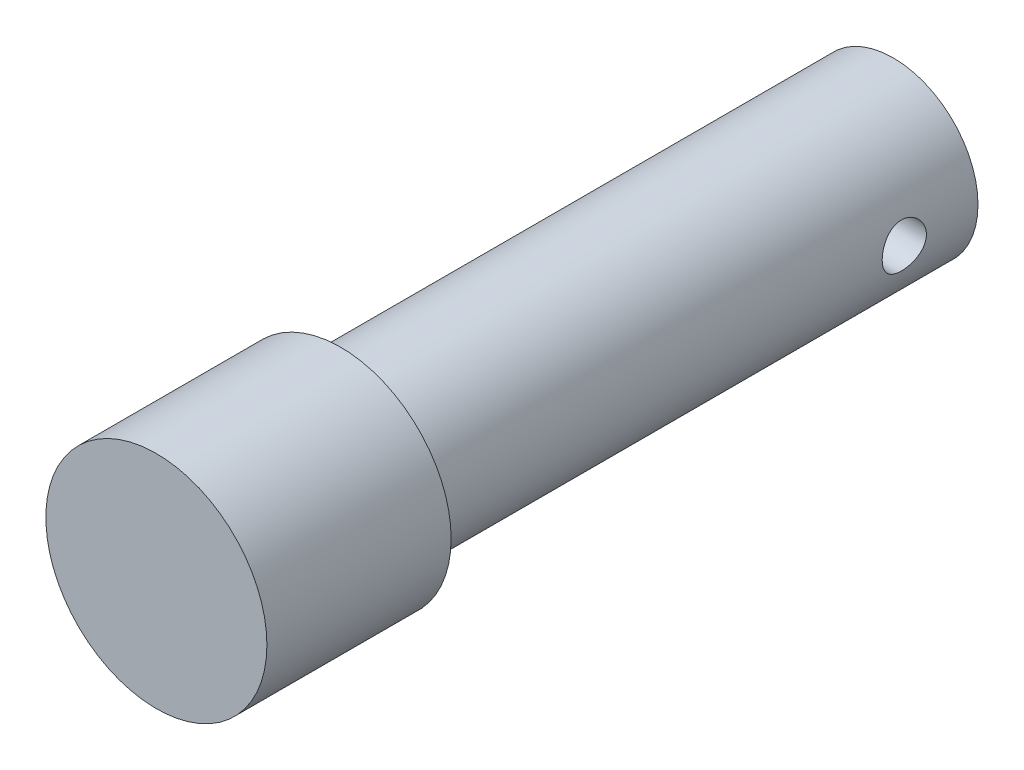
from build123d import *

# Parameters (mm, degrees)
SKETCH1_R               = 2.3
BOSS_EXTRUDE1_DEPTH     = 20
SKETCH2_R               = 3
BOSS_EXTRUDE2_DEPTH     = 5
CUT_EXTRUDE1_DEPTH      = 5
CUT_EXTRUDE1_DEPTH_BACK = 5
SKETCH3_R               = 0.6


with BuildPart() as part:
    # Sketch1 → Boss-Extrude1 (new body)
    with BuildSketch(Plane.XY):
        Circle(SKETCH1_R)
    extrude(amount=BOSS_EXTRUDE1_DEPTH)

    # Sketch2 → Boss-Extrude2 (add)
    with BuildSketch(Plane.XY.offset(20)):
        Circle(SKETCH2_R)
    extrude(amount=-BOSS_EXTRUDE2_DEPTH)

    # Sketch3 → Cut-Extrude1 (cut, two sides: drawn at the far end of the back side and taken through both)
    with BuildSketch(Plane(origin=(0, 0, 0), x_dir=(0, 0, -1), z_dir=(1, 0, 0)).offset(-CUT_EXTRUDE1_DEPTH_BACK)):
        with Locations((-2, 0)):
            Circle(SKETCH3_R)
    extrude(amount=CUT_EXTRUDE1_DEPTH + CUT_EXTRUDE1_DEPTH_BACK, mode=Mode.SUBTRACT)


solid = part.part
